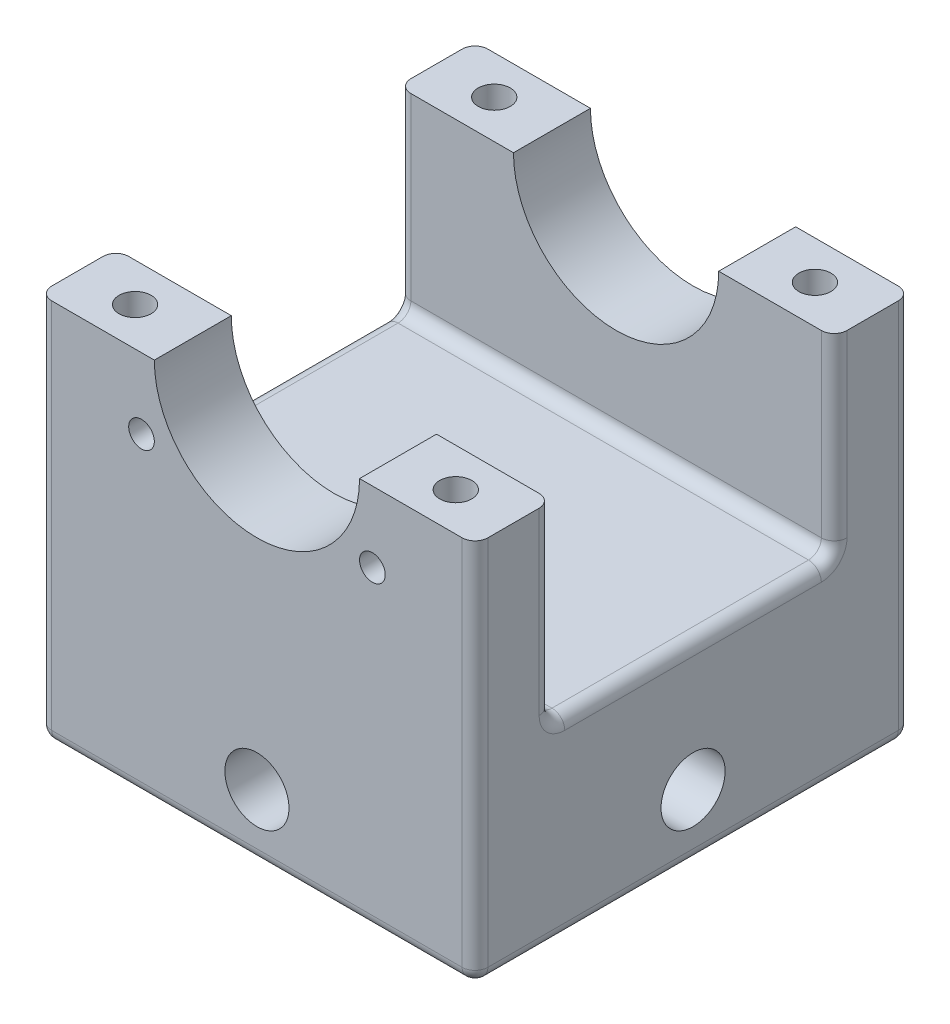
from build123d import *

# Parameters (mm, degrees)
SKETCH1_W           = 34
SKETCH1_H           = 34
BOSS_EXTRUDE1_DEPTH = 15
SKETCH2_W           = 20.2
SKETCH2_H           = 20.2
CUT_EXTRUDE1_DEPTH  = 10
SKETCH4_W           = 34
SKETCH4_H           = 15
BOSS_EXTRUDE2_DEPTH = 6
SKETCH7_R           = 8
CUT_EXTRUDE4_DEPTH  = 49.425200051
SKETCH17_R          = 1.25
CUT_EXTRUDE10_DEPTH = 10
SKETCH15_R          = 2.5
CUT_EXTRUDE8_DEPTH  = 49.425200051
SKETCH16_R          = 2.5
CUT_EXTRUDE9_DEPTH  = 49.425200051
FILLET2_R           = 1
SKETCH19_R          = 1
CUT_EXTRUDE12_DEPTH = 3


with BuildPart() as part:
    # Sketch1 → Boss-Extrude1 (new body)
    with BuildSketch(Plane(origin=(0, 0, 0), x_dir=(1, 0, 0), z_dir=(0, 1, 0))):
        Rectangle(SKETCH1_W, SKETCH1_H)
    extrude(amount=BOSS_EXTRUDE1_DEPTH)

    # Sketch2 → Cut-Extrude1 (cut)
    with BuildSketch(Plane.XZ):
        Rectangle(SKETCH2_W, SKETCH2_H)
    extrude(amount=-CUT_EXTRUDE1_DEPTH, mode=Mode.SUBTRACT)

    # Sketch4 → Boss-Extrude2 (add)
    with BuildSketch(Plane.XY.offset(17)):
        with Locations((0, 22.5)):
            Rectangle(SKETCH4_W, SKETCH4_H)
    boss_extrude2 = extrude(amount=-BOSS_EXTRUDE2_DEPTH)

    # Sketch7 → Cut-Extrude4 (cut, through all)
    with BuildSketch(Plane.XY.offset(17)):
        with Locations((0, 30)):
            Circle(SKETCH7_R)
    cut_extrude4 = extrude(amount=-CUT_EXTRUDE4_DEPTH, mode=Mode.SUBTRACT)

    # Sketch17 → Cut-Extrude10 (cut)
    with BuildSketch(Plane(origin=(0, 30, 0), x_dir=(1, 0, 0), z_dir=(0, 1, 0))):
        with Locations(Location((-12.5, -14, 0), (0, 0, 180))):
            Circle(SKETCH17_R)
        with Locations(Location((12.5, -14, 0), (0, 0, 180))):
            Circle(SKETCH17_R)
    cut_extrude10 = extrude(amount=-CUT_EXTRUDE10_DEPTH, mode=Mode.SUBTRACT)

    # Mirror1: Boss-Extrude2, Cut-Extrude4, Cut-Extrude10 across plane
    add(boss_extrude2.mirror(Plane.XY))
    add(cut_extrude4.mirror(Plane.XY), mode=Mode.SUBTRACT)
    add(cut_extrude10.mirror(Plane.XY), mode=Mode.SUBTRACT)

    # Sketch15 → Cut-Extrude8 (cut, through all)
    with BuildSketch(Plane(origin=(0, 0, -17), x_dir=(-1, 0, 0), z_dir=(0, 0, -1))):
        with Locations((0, 5)):
            Circle(SKETCH15_R)
    extrude(amount=-CUT_EXTRUDE8_DEPTH, mode=Mode.SUBTRACT)

    # Sketch16 → Cut-Extrude9 (cut, through all)
    with BuildSketch(Plane(origin=(17, 0, 0), x_dir=(0, 0, -1), z_dir=(1, 0, 0))):
        with Locations((0, 5)):
            Circle(SKETCH16_R)
    extrude(amount=-CUT_EXTRUDE9_DEPTH, mode=Mode.SUBTRACT)

    # Fillet2
    fillet2_edges = [part.edges().sort_by_distance(p)[0] for p in [
        (17, 15, 0),
        (17, 22.5, 11),
        (0, 15, 11),
        (-17, 22.5, 11),
        (0, 0, 17),
        (-17, 0, 0),
        (0, 0, -17),
        (17, 0, 0),
        (-17, 15, 0),
        (-17, 22.5, -11),
        (0, 15, -11),
        (17, 22.5, -11),
        (17, 15, 17),
        (-17, 15, 17),
        (-17, 15, -17),
        (17, 15, -17),
    ]]
    fillet(fillet2_edges, radius=FILLET2_R)

    # Sketch19 → Cut-Extrude12 (cut)
    with BuildSketch(Plane.XY.offset(17)):
        with Locations((-9, 24.5)):
            Circle(SKETCH19_R)
    cut_extrude12 = extrude(amount=-CUT_EXTRUDE12_DEPTH, mode=Mode.SUBTRACT)

    # Mirror2: Cut-Extrude12 across plane
    add(cut_extrude12.mirror(Plane(origin=(0, 0, 0), x_dir=(0, 0, 1), z_dir=(1, 0, 0))), mode=Mode.SUBTRACT)


solid = part.part
